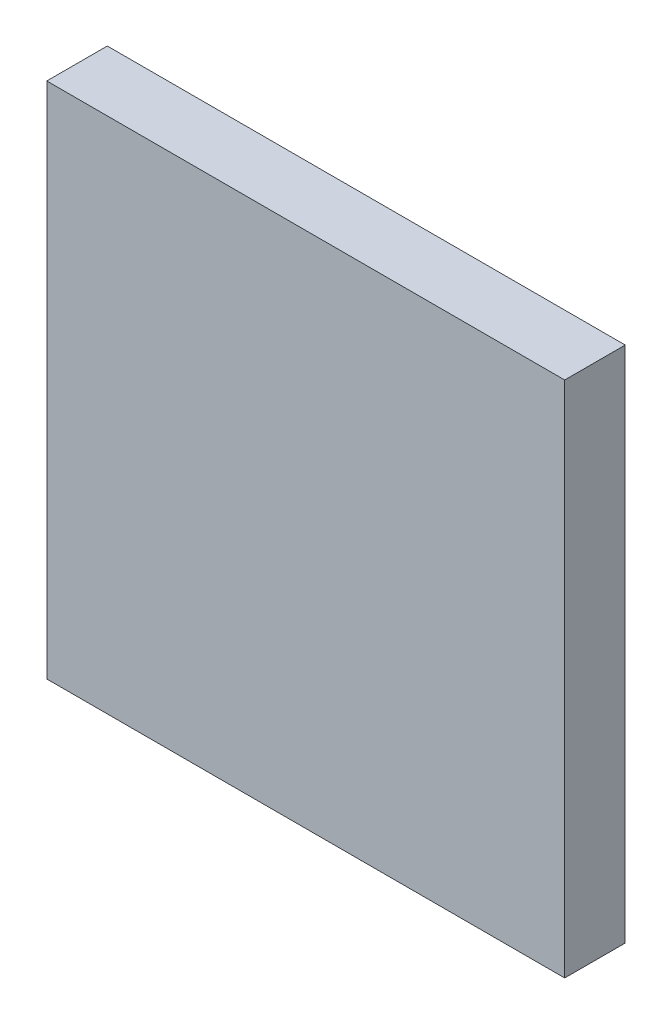
from build123d import *

# Parameters (mm, degrees)
P_IDAT_VYSUNUT_M1_DEPTH = 1.7
SKICA2_W                = 160
SKICA2_H                = 160
SKICA2_R                = 76
P_IDAT_VYSUNUT_M2_DEPTH = 15
SKICA4_W                = 160
SKICA4_H                = 160
P_IDAT_VYSUNUT_M3_DEPTH = 2


with BuildPart() as part:
    # Skica1 → Přidat vysunutím1 (new body)
    with BuildSketch(Plane.XY):
        with BuildLine():
            Line((-6.25, -75.742573893), (-6.25, -80))
            Line((-6.25, -80), (-80, -80))
            Line((-80, -80), (-80, 80))
            Line((-80, 80), (80, 80))
            Line((80, 80), (80, -80))
            Line((80, -80), (6.25, -80))
            Line((6.25, -80), (6.25, -75.742573893))
            ThreePointArc((6.25, -75.742573893), (0, 76), (-6.25, -75.742573893))
        make_face()
    extrude(amount=P_IDAT_VYSUNUT_M1_DEPTH)

    # Skica2 → Přidat vysunutím2 (add)
    with BuildSketch(Plane.XY.offset(1.7)):
        Rectangle(SKICA2_W, SKICA2_H)
        with Locations(Location((0, 0, 0), (0, 0, 265.282848868))):
            Circle(SKICA2_R, mode=Mode.SUBTRACT)
    extrude(amount=P_IDAT_VYSUNUT_M2_DEPTH)

    # Skica4 → Přidat vysunutím3 (add)
    with BuildSketch(Plane.XY.offset(16.7)):
        Rectangle(SKICA4_W, SKICA4_H)
    extrude(amount=P_IDAT_VYSUNUT_M3_DEPTH)


solid = part.part
